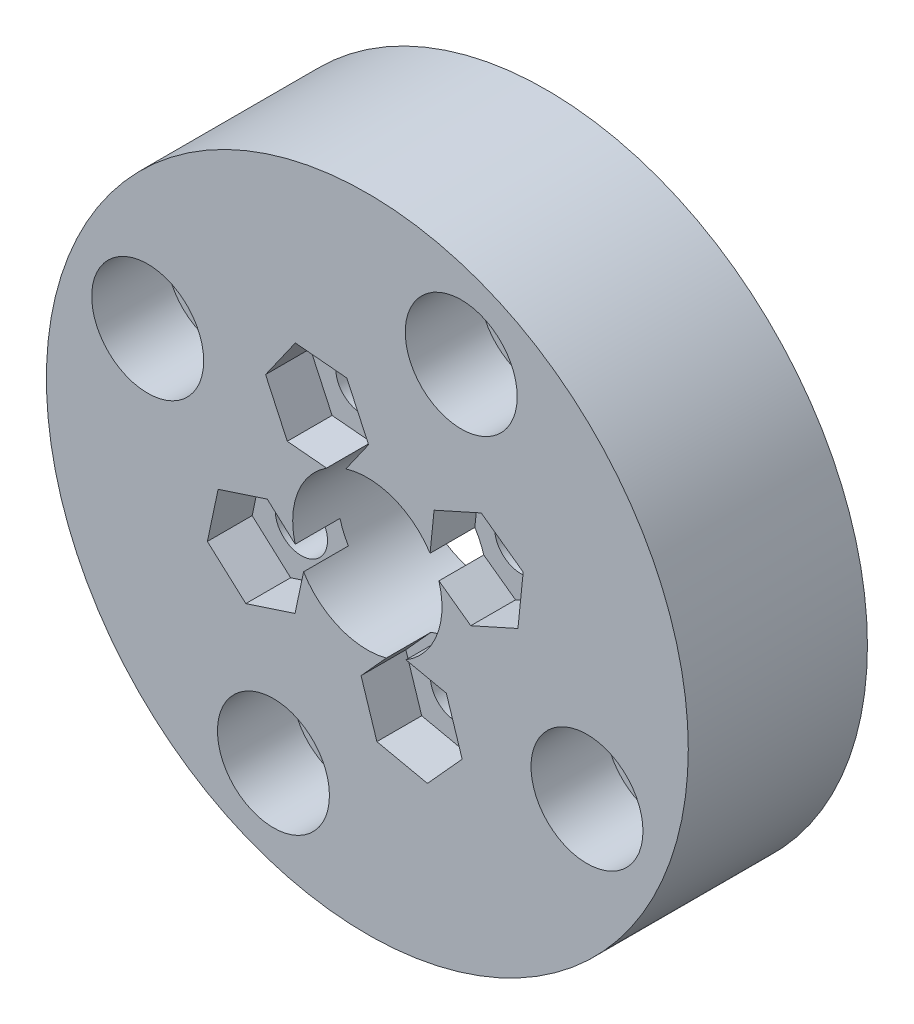
from build123d import *

# Parameters (mm, degrees)
ESQUISSE1_R             = 21.5
ESQUISSE1_R_2           = 11.25
BOSS_EXTRU_1_DEPTH      = 12
ESQUISSE2_R             = 2.5
ENL_V_MAT_EXTRU_1_DEPTH = 33.687918257
ESQUISSE4_R             = 3.75
ENL_V_MAT_EXTRU_2_DEPTH = 5
BOSS_EXTRU_2_START      = -8
ESQUISSE5_R             = 11.25
BOSS_EXTRU_2_DEPTH      = 8
ESQUISSE6_R             = 5
ENL_V_MAT_EXTRU_3_DEPTH = 50
ESQUISSE7_R             = 1.75
ENL_V_MAT_EXTRU_4_DEPTH = 11
ENL_V_MAT_EXTRU_5_DEPTH = 3


with BuildPart() as part:
    # Esquisse1 → Boss.-Extru.1 (new body)
    with BuildSketch(Plane.XY):
        Circle(ESQUISSE1_R)
        Circle(ESQUISSE1_R_2, mode=Mode.SUBTRACT)
    extrude(amount=BOSS_EXTRU_1_DEPTH)

    # Esquisse2 → Enlèv. mat.-Extru.1 (cut, through all)
    with BuildSketch(Plane.XY.offset(12)):
        with Locations((-14.713385832, 6.286197369)):
            Circle(ESQUISSE2_R)
        with Locations((6.28955657, 14.711950182)):
            Circle(ESQUISSE2_R)
        with Locations((14.713385832, -6.286197369)):
            Circle(ESQUISSE2_R)
        with Locations((-6.28955657, -14.711950182)):
            Circle(ESQUISSE2_R)
    extrude(amount=-ENL_V_MAT_EXTRU_1_DEPTH, mode=Mode.SUBTRACT)

    # Esquisse4 → Enlèv. mat.-Extru.2 (cut)
    with BuildSketch(Plane.XY.offset(12)):
        with Locations((-6.28955657, -14.711950182)):
            Circle(ESQUISSE4_R)
        with Locations((14.713385832, -6.286197369)):
            Circle(ESQUISSE4_R)
        with Locations((6.28955657, 14.711950182)):
            Circle(ESQUISSE4_R)
        with Locations((-14.713385832, 6.286197369)):
            Circle(ESQUISSE4_R)
    extrude(amount=-ENL_V_MAT_EXTRU_2_DEPTH, mode=Mode.SUBTRACT)

    # Esquisse5 → Boss.-Extru.2 (add)
    with BuildSketch(Plane.XY.offset(12).offset(BOSS_EXTRU_2_START)):
        Circle(ESQUISSE5_R)
    extrude(amount=BOSS_EXTRU_2_DEPTH)

    # Esquisse6 → Enlèv. mat.-Extru.3 (cut)
    with BuildSketch(Plane(origin=(0, 0, 4), x_dir=(-1, 0, 0), z_dir=(0, 0, -1))):
        Circle(ESQUISSE6_R)
    extrude(amount=-ENL_V_MAT_EXTRU_3_DEPTH, mode=Mode.SUBTRACT)

    # Esquisse7 → Enlèv. mat.-Extru.4 (cut)
    with BuildSketch(Plane(origin=(0, 0, 4), x_dir=(-1, 0, 0), z_dir=(0, 0, -1))):
        with Locations((7.420247562, -2.989970922)):
            Circle(ESQUISSE7_R)
        with Locations((-2.965758016, -7.429958236)):
            Circle(ESQUISSE7_R)
        with Locations((-7.27947207, 3.31802447)):
            Circle(ESQUISSE7_R)
        with Locations((3.367275567, 7.256821292)):
            Circle(ESQUISSE7_R)
    extrude(amount=-ENL_V_MAT_EXTRU_4_DEPTH, mode=Mode.SUBTRACT)

    # Esquisse8 → Enlèv. mat.-Extru.5 (cut)
    with BuildSketch(Plane.XY.offset(12)):
        Polygon((-6.817345267, 7.56830012), (-5.362058995, 4.4247127), (-1.911989294, 4.113233872), (0.082794134, 6.945342463), (-1.372492138, 10.088929883), (-4.822561839, 10.400408711), align=None)
        Polygon((7.630709315, 6.764273503), (4.470551482, 5.345329364), (4.119314237, 1.899080331), (6.928234824, -0.128224563), (10.088392657, 1.290719576), (10.439629903, 4.736968609), align=None)
        Polygon((6.351992849, -8.160309971), (5.291378589, -4.862568715), (1.905143756, -4.13221698), (-0.420476817, -6.699606501), (0.640137444, -9.997347757), (4.026372276, -10.727699492), align=None)
        Polygon((-6.701502779, 0.398746525), (-9.995590566, -0.673160957), (-10.71433535, -4.061878404), (-8.138992346, -6.378688369), (-4.844904559, -5.306780887), (-4.126159775, -1.91806344), align=None)
    extrude(amount=-ENL_V_MAT_EXTRU_5_DEPTH, mode=Mode.SUBTRACT)


solid = part.part
